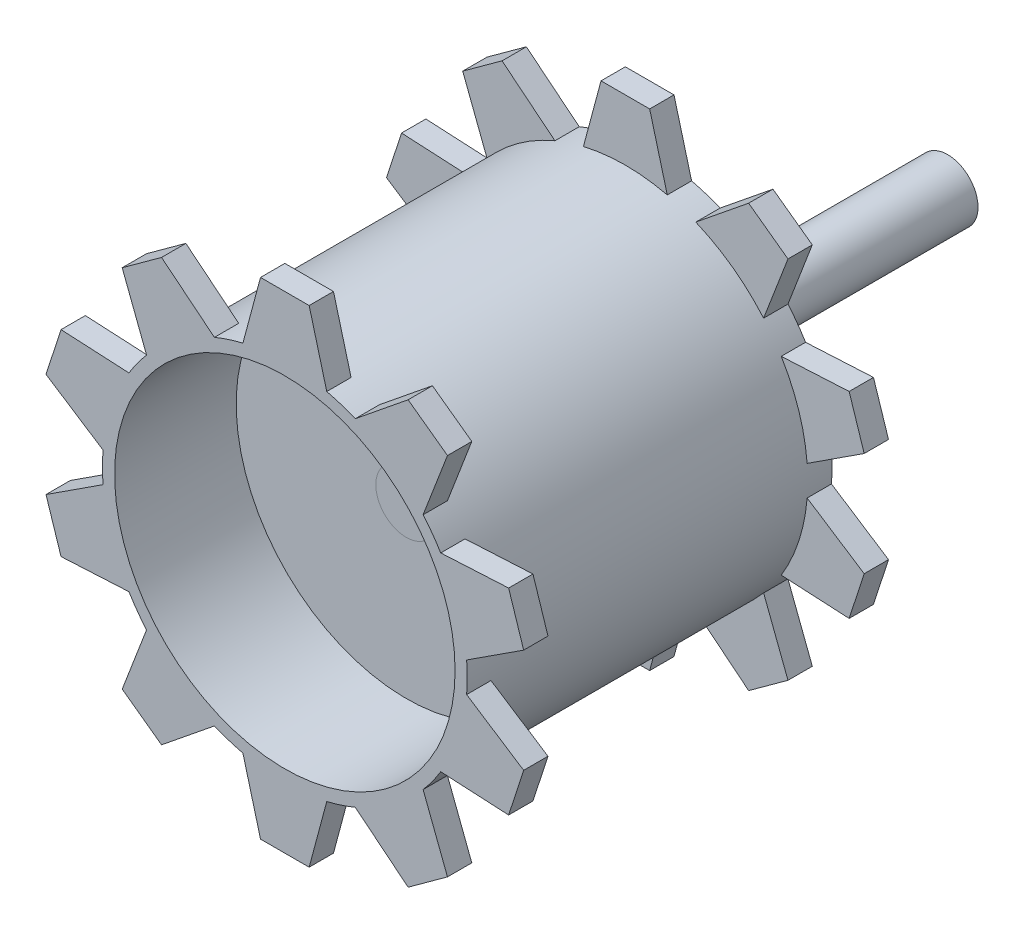
from build123d import *

# Parameters (mm, degrees)
BOSS_EXTRUDE1_DEPTH      = 25
BOSS_EXTRUDE1_DEPTH_BACK = 25
SKETCH2_R                = 70
BOSS_EXTRUDE2_DEPTH      = 50
BOSS_EXTRUDE2_DEPTH_BACK = 100
SKETCH3_R                = 75
SKETCH3_R_2              = 70
BOSS_EXTRUDE3_DEPTH      = 10
CIRPATTERN1_COUNT        = 10
MIRROR1_COPY_1_DEPTH     = 10
MIRROR1_COPY_2_DEPTH     = 10
MIRROR1_COPY_3_DEPTH     = 10
MIRROR1_COPY_4_DEPTH     = 10
MIRROR1_COPY_5_DEPTH     = 10
MIRROR1_COPY_6_DEPTH     = 10
MIRROR1_COPY_7_DEPTH     = 10
MIRROR1_COPY_8_DEPTH     = 10
MIRROR1_COPY_9_DEPTH     = 10
MIRROR1_COPY_10_DEPTH    = 10
BOSS_EXTRUDE4_DEPTH      = 0.1
BOSS_EXTRUDE4_DEPTH_BACK = 222.49372628
SKETCH5_R                = 12.5


with BuildPart() as part:
    # Sketch2 → Boss-Extrude1 (new, two sides: drawn at the far end of the back side and taken through both)
    with BuildSketch(Plane.XY.offset(-BOSS_EXTRUDE1_DEPTH_BACK)):
        Circle(SKETCH2_R)
    extrude(amount=BOSS_EXTRUDE1_DEPTH + BOSS_EXTRUDE1_DEPTH_BACK)

    # Sketch3 → Boss-Extrude2 (add, two sides: drawn at the far end of the back side and taken through both)
    with BuildSketch(Plane.XY.offset(25).offset(-BOSS_EXTRUDE2_DEPTH_BACK)):
        Circle(SKETCH3_R)
        Circle(SKETCH3_R_2, mode=Mode.SUBTRACT)
    extrude(amount=BOSS_EXTRUDE2_DEPTH + BOSS_EXTRUDE2_DEPTH_BACK)

    # Sketch4 → Boss-Extrude3 (add)
    with BuildSketch(Plane.XY.offset(75)):
        with BuildLine():
            Line((-10, 100), (10, 100))
            Line((10, 100), (17.23665102, 72.992450717))
            ThreePointArc((17.23665102, 72.992450717), (0, 75), (-17.23665102, 72.992450717))
            Line((-17.23665102, 72.992450717), (-10, 100))
        make_face()
    boss_extrude3 = extrude(amount=-BOSS_EXTRUDE3_DEPTH)

    # CirPattern1: Boss-Extrude3 ×10 about axis
    cirpattern1_axis = Axis((0, 0, 75), (0, 0, 1))
    for i in range(1, CIRPATTERN1_COUNT):
        add(boss_extrude3.rotate(cirpattern1_axis, i * 360 / CIRPATTERN1_COUNT))

    # Mirror1 copy 1 sketch → Mirror1 copy 1 (add)
    with BuildSketch(Plane(origin=(0, 0, -75), x_dir=(0.8090169943749475, 0.5877852522924731, 0), z_dir=(0, 0, -1))):
        with BuildLine():
            Line((-10, -100), (10, -100))
            Line((10, -100), (17.23665102, -72.992450717))
            ThreePointArc((17.23665102, -72.992450717), (0, -75), (-17.23665102, -72.992450717))
            Line((-17.23665102, -72.992450717), (-10, -100))
        make_face()
    extrude(amount=-MIRROR1_COPY_1_DEPTH)

    # Mirror1 copy 2 sketch → Mirror1 copy 2 (add)
    with BuildSketch(Plane(origin=(0, 0, -75), x_dir=(0.30901699437494745, 0.9510565162951535, 0), z_dir=(0, 0, -1))):
        with BuildLine():
            Line((-10, -100), (10, -100))
            Line((10, -100), (17.23665102, -72.992450717))
            ThreePointArc((17.23665102, -72.992450717), (0, -75), (-17.23665102, -72.992450717))
            Line((-17.23665102, -72.992450717), (-10, -100))
        make_face()
    extrude(amount=-MIRROR1_COPY_2_DEPTH)

    # Mirror1 copy 3 sketch → Mirror1 copy 3 (add)
    with BuildSketch(Plane(origin=(0, 0, -75), x_dir=(-0.30901699437494734, 0.9510565162951536, 0), z_dir=(0, 0, -1))):
        with BuildLine():
            Line((-10, -100), (10, -100))
            Line((10, -100), (17.23665102, -72.992450717))
            ThreePointArc((17.23665102, -72.992450717), (0, -75), (-17.23665102, -72.992450717))
            Line((-17.23665102, -72.992450717), (-10, -100))
        make_face()
    extrude(amount=-MIRROR1_COPY_3_DEPTH)

    # Mirror1 copy 4 sketch → Mirror1 copy 4 (add)
    with BuildSketch(Plane(origin=(0, 0, -75), x_dir=(-0.8090169943749473, 0.5877852522924732, 0), z_dir=(0, 0, -1))):
        with BuildLine():
            Line((-10, -100), (10, -100))
            Line((10, -100), (17.23665102, -72.992450717))
            ThreePointArc((17.23665102, -72.992450717), (0, -75), (-17.23665102, -72.992450717))
            Line((-17.23665102, -72.992450717), (-10, -100))
        make_face()
    extrude(amount=-MIRROR1_COPY_4_DEPTH)

    # Mirror1 copy 5 sketch → Mirror1 copy 5 (add)
    with BuildSketch(Plane(origin=(0, 0, -75), x_dir=(-1, 0, 0), z_dir=(0, 0, -1))):
        with BuildLine():
            Line((-10, -100), (10, -100))
            Line((10, -100), (17.23665102, -72.992450717))
            ThreePointArc((17.23665102, -72.992450717), (0, -75), (-17.23665102, -72.992450717))
            Line((-17.23665102, -72.992450717), (-10, -100))
        make_face()
    extrude(amount=-MIRROR1_COPY_5_DEPTH)

    # Mirror1 copy 6 sketch → Mirror1 copy 6 (add)
    with BuildSketch(Plane(origin=(0, 0, -75), x_dir=(-0.8090169943749476, -0.587785252292473, 0), z_dir=(0, 0, -1))):
        with BuildLine():
            Line((-10, -100), (10, -100))
            Line((10, -100), (17.23665102, -72.992450717))
            ThreePointArc((17.23665102, -72.992450717), (0, -75), (-17.23665102, -72.992450717))
            Line((-17.23665102, -72.992450717), (-10, -100))
        make_face()
    extrude(amount=-MIRROR1_COPY_6_DEPTH)

    # Mirror1 copy 7 sketch → Mirror1 copy 7 (add)
    with BuildSketch(Plane(origin=(0, 0, -75), x_dir=(-0.30901699437494756, -0.9510565162951535, 0), z_dir=(0, 0, -1))):
        with BuildLine():
            Line((-10, -100), (10, -100))
            Line((10, -100), (17.23665102, -72.992450717))
            ThreePointArc((17.23665102, -72.992450717), (0, -75), (-17.23665102, -72.992450717))
            Line((-17.23665102, -72.992450717), (-10, -100))
        make_face()
    extrude(amount=-MIRROR1_COPY_7_DEPTH)

    # Mirror1 copy 8 sketch → Mirror1 copy 8 (add)
    with BuildSketch(Plane(origin=(0, 0, -75), x_dir=(0.30901699437494723, -0.9510565162951536, 0), z_dir=(0, 0, -1))):
        with BuildLine():
            Line((-10, -100), (10, -100))
            Line((10, -100), (17.23665102, -72.992450717))
            ThreePointArc((17.23665102, -72.992450717), (0, -75), (-17.23665102, -72.992450717))
            Line((-17.23665102, -72.992450717), (-10, -100))
        make_face()
    extrude(amount=-MIRROR1_COPY_8_DEPTH)

    # Mirror1 copy 9 sketch → Mirror1 copy 9 (add)
    with BuildSketch(Plane(origin=(0, 0, -75), x_dir=(0.8090169943749473, -0.5877852522924734, 0), z_dir=(0, 0, -1))):
        with BuildLine():
            Line((-10, -100), (10, -100))
            Line((10, -100), (17.23665102, -72.992450717))
            ThreePointArc((17.23665102, -72.992450717), (0, -75), (-17.23665102, -72.992450717))
            Line((-17.23665102, -72.992450717), (-10, -100))
        make_face()
    extrude(amount=-MIRROR1_COPY_9_DEPTH)

    # Mirror1 copy 10 sketch → Mirror1 copy 10 (add)
    with BuildSketch(Plane(origin=(0, 0, -75), x_dir=(1, 0, 0), z_dir=(0, 0, -1))):
        with BuildLine():
            Line((-10, -100), (10, -100))
            Line((10, -100), (17.23665102, -72.992450717))
            ThreePointArc((17.23665102, -72.992450717), (0, -75), (-17.23665102, -72.992450717))
            Line((-17.23665102, -72.992450717), (-10, -100))
        make_face()
    extrude(amount=-MIRROR1_COPY_10_DEPTH)


with BuildPart() as body_2:
    # Sketch5 → Boss-Extrude4 (new, two sides: drawn at the far end of the back side and taken through both)
    with BuildSketch(Plane.XY.offset(25).offset(-BOSS_EXTRUDE4_DEPTH_BACK)):
        Circle(SKETCH5_R)
    extrude(amount=BOSS_EXTRUDE4_DEPTH + BOSS_EXTRUDE4_DEPTH_BACK)


solid = Compound([part.part, body_2.part])
